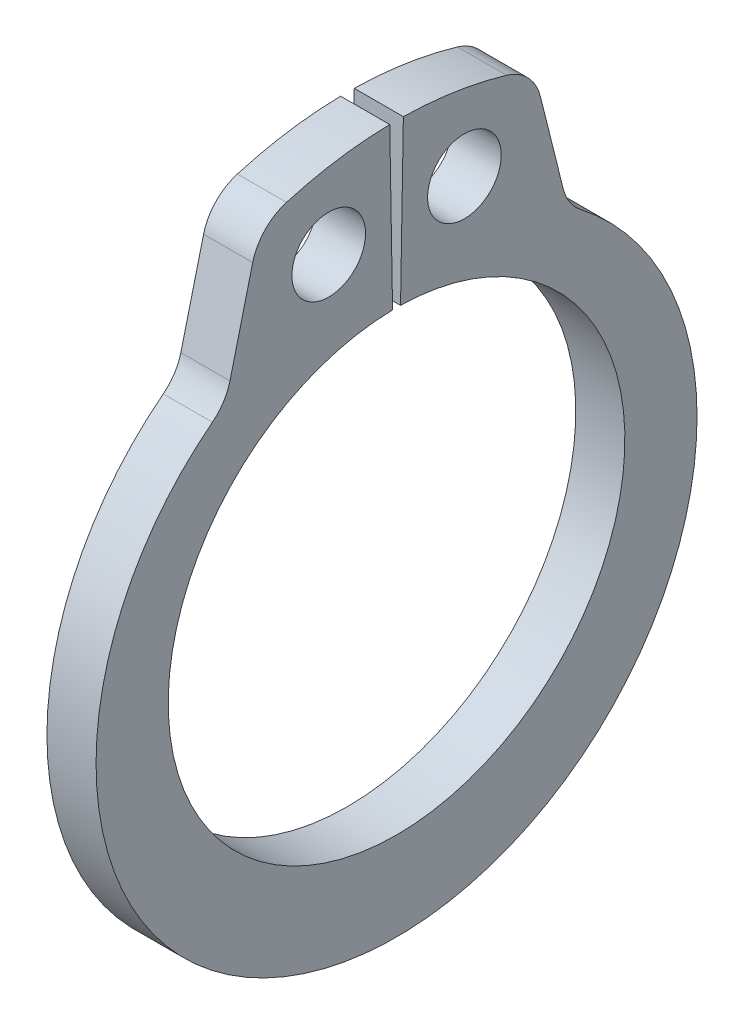
from build123d import *

# Parameters (mm, degrees)
SKETCH1_R      = 0.75
EXTRUDE1_DEPTH = 0.5
FILLET1_R      = 1


with BuildPart() as part:
    # Sketch1 → Extrude1 (new, symmetric)
    with BuildSketch(Plane(origin=(0, 0, 0), x_dir=(0, 0, -1), z_dir=(1, 0, 0))):
        with BuildLine():
            Line((-0.08115369, 4.649291782), (-0.138746631, 7.948789176))
            ThreePointArc((-0.138746631, 7.948789176), (-1.489555873, 7.809207598), (-2.796901767, 7.441763266))
            Line((-2.796901767, 7.441763266), (-3.479894649, 4.70242844))
            ThreePointArc((-3.479894649, 4.70242844), (0, -6.45), (3.479894649, 4.70242844))
            Line((3.479894649, 4.70242844), (2.796901767, 7.441763266))
            ThreePointArc((2.796901767, 7.441763266), (1.489555873, 7.809207598), (0.138746631, 7.948789176))
            Line((0.138746631, 7.948789176), (0.08115369, 4.649291782))
            ThreePointArc((0.08115369, 4.649291782), (0, -4.65), (-0.08115369, 4.649291782))
        make_face()
        with Locations((-1.381353042, 6.27684806)):
            Circle(SKETCH1_R, mode=Mode.SUBTRACT)
        with Locations((1.381353042, 6.27684806)):
            Circle(SKETCH1_R, mode=Mode.SUBTRACT)
    extrude(amount=EXTRUDE1_DEPTH, both=True)

    # Fillet1
    fillet1_edges = [part.edges().sort_by_distance(p)[0] for p in [
        (0, 7.441763266, -2.796901767),
        (0, 4.70242844, -3.479894649),
        (0, 4.70242844, 3.479894649),
        (0, 7.441763266, 2.796901767),
    ]]
    fillet(fillet1_edges, radius=FILLET1_R)


solid = part.part
